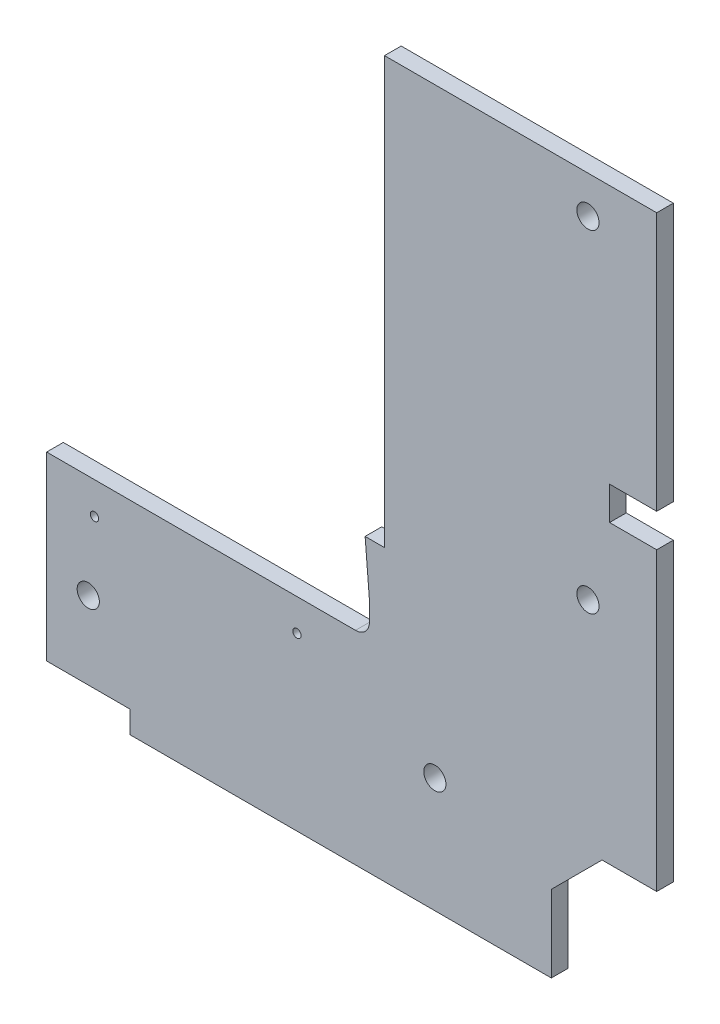
from build123d import *

# Parameters (mm, degrees)
BOSS_EXTRUDE2_DEPTH      = 6
SKETCH2_R                = 4
SKETCH2_W                = 30
SKETCH2_H                = 8.3
CUT_EXTRUDE1_DEPTH       = 341.487943986
CROQUIS1_W               = 103.610606389
CROQUIS1_H               = 1.56
SALIENTE_EXTRUIR2_DEPTH  = 6
SALIENTE_EXTRUIR3_DEPTH  = 6
SALIENTE_EXTRUIR4_START  = -6
SALIENTE_EXTRUIR4_DEPTH  = 6
SALIENTE_EXTRUIR5_DEPTH  = 6
SALIENTE_EXTRUIR6_DEPTH  = 6
CROQUIS7_W               = 103.610606389
CROQUIS7_H               = 0.56
SALIENTE_EXTRUIR7_DEPTH  = 6
SALIENTE_EXTRUIR8_DEPTH  = 6
SKETCH3_R                = 1.5
CUT_EXTRUDE2_DEPTH       = 341.487943986
CUT_EXTRUDE3_DEPTH       = 341.487943986
CROQUIS9_W               = 152
CROQUIS9_H               = 0.3
CORTAR_EXTRUIR1_DEPTH    = 10
CORTAR_EXTRUIR2_DEPTH    = 6
CROQUIS14_W              = 17
CROQUIS14_H              = 12
CORTAR_EXTRUIR4_DEPTH    = 10
CROQUIS15_R              = 4
CORTAR_EXTRUIR5_DEPTH    = 10
SALIENTE_EXTRUIR10_DEPTH = 6
SALIENTE_EXTRUIR11_DEPTH = 6
CROQUIS18_W              = 98.157526679
CROQUIS18_H              = 1.5
CORTAR_EXTRUIR6_DEPTH    = 6


with BuildPart() as part:
    # Sketch1 → Boss-Extrude2 (new body)
    with BuildSketch(Plane.XY):
        with BuildLine():
            Line((0, 0), (-220, 0))
            Line((-220, 0), (-220, 71.45))
            Line((-220, 71.45), (-116.389393611, 71.45))
            ThreePointArc((-116.389393611, 71.45), (-107.149394721, 74.662079518), (-101.894274329, 82.913063942))
            Line((-101.894274329, 82.913063942), (-60, 259.8))
            Line((-60, 259.8), (0, 259.8))
            Line((0, 259.8), (0, 0))
        make_face()
    extrude(amount=BOSS_EXTRUDE2_DEPTH)

    # Sketch2 → Cut-Extrude1 (cut, through all)
    with BuildSketch(Plane.XY.offset(6)):
        with Locations((-205, 36.3)):
            Circle(SKETCH2_R)
        with Locations((-24.8, 244.8)):
            Circle(SKETCH2_R)
        with Locations((-24.8, 125)):
            Circle(SKETCH2_R)
        with Locations((-80, 36.3)):
            Circle(SKETCH2_R)
        with Locations((-205, 4.15)):
            Rectangle(SKETCH2_W, SKETCH2_H)
        Polygon((-38, 0), (-38, 19), (-10.7, 46.3), (0, 46.3), (0, 0), align=None)
    extrude(amount=-CUT_EXTRUDE1_DEPTH, mode=Mode.SUBTRACT)

    # Croquis1 → Saliente-Extruir2 (add)
    with BuildSketch(Plane.XY.offset(6)):
        with Locations((-168.194696806, 72.23)):
            Rectangle(CROQUIS1_W, CROQUIS1_H)
    extrude(amount=-SALIENTE_EXTRUIR2_DEPTH)

    # Croquis3 → Saliente-Extruir3 (add)
    with BuildSketch(Plane.XY.offset(6)):
        Polygon((-101.894274329, 82.913063942), (-103.412279578, 83.272591501), (-60, 259.8), align=None)
    extrude(amount=-SALIENTE_EXTRUIR3_DEPTH)

    # Croquis4 → Saliente-Extruir4 (add)
    with BuildSketch(Plane.XY.offset(6).offset(SALIENTE_EXTRUIR4_START)):
        with BuildLine():
            Line((-103.412279578, 83.272591501), (-101.894274329, 82.913063942))
            ThreePointArc((-101.894274329, 82.913063942), (-107.149394721, 74.662079518), (-116.389393611, 71.45))
            Line((-116.389393611, 71.45), (-116.389393611, 73.01))
            ThreePointArc((-116.389393611, 73.01), (-108.117056079, 75.88569363), (-103.412279578, 83.272591501))
        make_face()
    extrude(amount=SALIENTE_EXTRUIR4_DEPTH)

    # Croquis5 → Saliente-Extruir5 (add)
    with BuildSketch(Plane.XY.offset(6)):
        Polygon((-105, 102.74), (-55, 102.74), (-103.412279578, 83.272591501), align=None)
    extrude(amount=-SALIENTE_EXTRUIR5_DEPTH)

    # Croquis6 → Saliente-Extruir6 (add)
    with BuildSketch(Plane.XY.offset(6)):
        Polygon((-98.157526679, 104.64), (-105.154959958, 104.64), (-105, 102.74), (-98.624781775, 102.74), align=None)
    extrude(amount=-SALIENTE_EXTRUIR6_DEPTH)

    # Croquis7 → Saliente-Extruir7 (add)
    with BuildSketch(Plane.XY.offset(6)):
        with Locations((-168.194696806, 73.29)):
            Rectangle(CROQUIS7_W, CROQUIS7_H)
    extrude(amount=-SALIENTE_EXTRUIR7_DEPTH)

    # Croquis8 → Saliente-Extruir8 (add)
    with BuildSketch(Plane.XY.offset(6)):
        with BuildLine():
            Line((-116.389393611, 73.57), (-117.98880457, 71.652693326))
            Line((-117.98880457, 71.652693326), (-105.380568296, 73.057716723))
            Line((-105.380568296, 73.057716723), (-100.684832206, 83.373546401))
            Line((-100.684832206, 83.373546401), (-103.622774874, 85.853523162))
            ThreePointArc((-103.622774874, 85.853523162), (-107.531184208, 77.13952683), (-116.389393611, 73.57))
        make_face()
    extrude(amount=-SALIENTE_EXTRUIR8_DEPTH)

    # Sketch3 → Cut-Extrude2 (cut, through all)
    with BuildSketch(Plane.XY.offset(6)):
        with Locations((-202.75, 62.07)):
            Circle(SKETCH3_R)
        with Locations((-129.75, 62.07)):
            Circle(SKETCH3_R)
    extrude(amount=-CUT_EXTRUDE2_DEPTH, mode=Mode.SUBTRACT)

    # Sketch4 → Cut-Extrude3 (cut, through all)
    with BuildSketch(Plane.XY.offset(6)):
        with BuildLine():
            Line((-103.622774874, 85.853523162), (-103.622774874, 78.57))
            ThreePointArc((-103.622774874, 78.57), (-105.087240968, 75.034466094), (-108.622774874, 73.57))
            Line((-108.622774874, 73.57), (-116.389393611, 73.57))
            ThreePointArc((-116.389393611, 73.57), (-107.531184208, 77.13952683), (-103.622774874, 85.853523162))
        make_face()
    extrude(amount=-CUT_EXTRUDE3_DEPTH, mode=Mode.SUBTRACT)

    # Croquis9 → Cortar-Extruir1 (cut)
    with BuildSketch(Plane.XY.offset(6)):
        with Locations((-114, 0.15)):
            Rectangle(CROQUIS9_W, CROQUIS9_H)
    extrude(amount=-CORTAR_EXTRUIR1_DEPTH, mode=Mode.SUBTRACT)

    # Croquis11 → Cortar-Extruir2 (cut)
    with BuildSketch(Plane.XY.offset(6)):
        Polygon((-10.7, 46.3), (-19.7, 46.3), (-38, 28), (-38, 19), align=None)
    extrude(amount=-CORTAR_EXTRUIR2_DEPTH, mode=Mode.SUBTRACT)

    # Croquis14 → Cortar-Extruir4 (cut)
    with BuildSketch(Plane.XY.offset(6)):
        with Locations((-8.5, 159.05)):
            Rectangle(CROQUIS14_W, CROQUIS14_H)
    extrude(amount=-CORTAR_EXTRUIR4_DEPTH, mode=Mode.SUBTRACT)

    # Croquis15 → Cortar-Extruir5 (cut)
    with BuildSketch(Plane.XY.offset(6)):
        with Locations((-80, 41.8)):
            Circle(CROQUIS15_R)
    extrude(amount=-CORTAR_EXTRUIR5_DEPTH, mode=Mode.SUBTRACT)

    # Croquis16 → Saliente-Extruir10 (add)
    with BuildSketch(Plane.XY.offset(6)):
        with BuildLine():
            ThreePointArc((-77.09526249, 39.05), (-80, 37.8), (-82.90473751, 39.05))
            ThreePointArc((-82.90473751, 39.05), (-80, 32.3), (-77.09526249, 39.05))
        make_face()
    extrude(amount=-SALIENTE_EXTRUIR10_DEPTH)

    # Croquis17 → Saliente-Extruir11 (add)
    with BuildSketch(Plane.XY.offset(6)):
        Polygon((-98.157526679, 104.64), (-98.157526679, 259.8), (-60, 259.8), align=None)
    extrude(amount=-SALIENTE_EXTRUIR11_DEPTH)

    # Croquis18 → Cortar-Extruir6 (cut)
    with BuildSketch(Plane.XY.offset(6)):
        with Locations((-49.07876334, 259.05)):
            Rectangle(CROQUIS18_W, CROQUIS18_H)
    extrude(amount=-CORTAR_EXTRUIR6_DEPTH, mode=Mode.SUBTRACT)


solid = part.part
